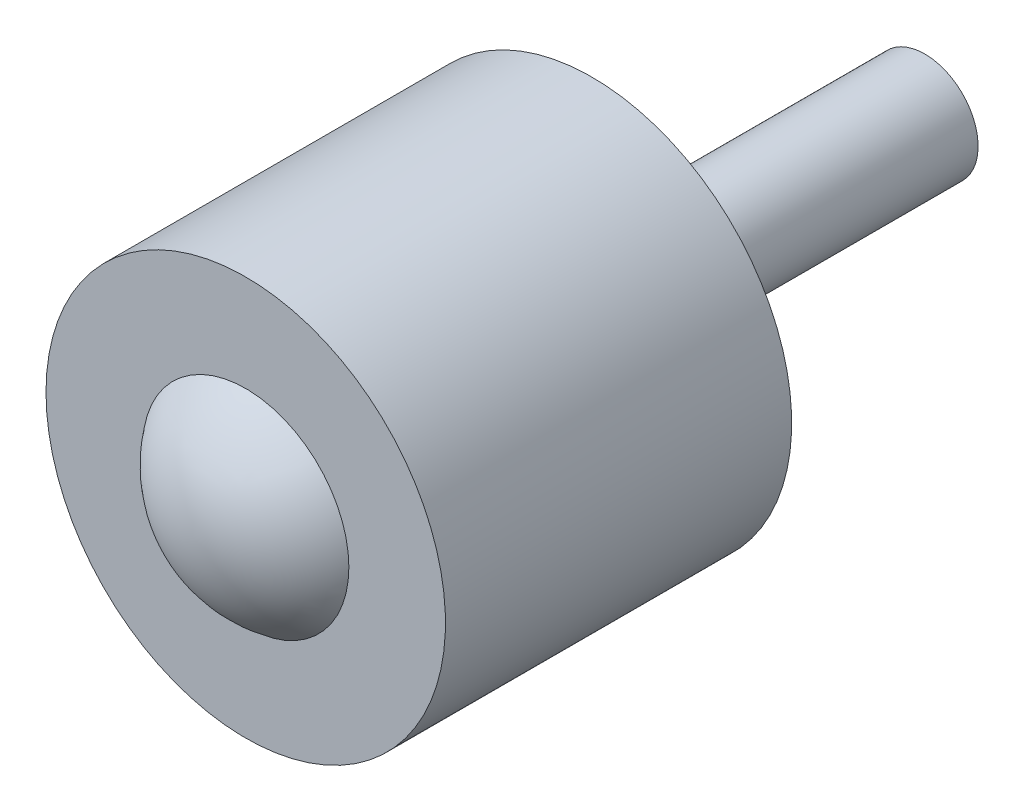
from build123d import *

# Parameters (mm, degrees)
SKETCH3_R           = 4
BOSS_EXTRUDE1_DEPTH = 25


with BuildPart() as part:
    # Sketch1 → Revolve6 (revolve)
    with BuildSketch(Plane(origin=(0, 0, 0), x_dir=(1, 0, 0), z_dir=(0, 1, 0))):
        with BuildLine():
            Line((0, 9.5), (0, -9.5))
            ThreePointArc((0, -9.5), (-9.5, 0), (0, 9.5))
        make_face()
    revolve(axis=Axis((0, 0, -9.5), (0, 0, 1)))

    # Sketch2 → Revolve7 (revolve)
    with BuildSketch(Plane(origin=(0, 0, 0), x_dir=(1, 0, 0), z_dir=(0, 1, 0)), mode=Mode.PRIVATE) as revolve7_sk:
        with BuildLine():
            ThreePointArc((-7.745966692, -5.5), (-9.050875195, -2.886461192), (-9.5, 0))
            Line((-9.5, 0), (-15, 0))
            Line((-15, 0), (-15, -5.5))
            Line((-15, -5.5), (-7.745966692, -5.5))
        make_face()
        with BuildLine():
            Line((-15, 0), (-9.5, 0))
            ThreePointArc((-9.5, 0), (-6.717514421, 6.717514421), (0, 9.5))
            Line((0, 9.5), (0, 20.5))
            Line((0, 20.5), (-15, 20.5))
            Line((-15, 20.5), (-15, 0))
        make_face()
    revolve(revolve7_sk.sketch.rotate(Axis((0, 0, -20.5), (0, 0, 1)), 180), axis=Axis((0, 0, -20.5), (0, 0, 1)))

    # Sketch3 → Boss-Extrude1 (add)
    with BuildSketch(Plane(origin=(0, 0, -20.5), x_dir=(-1, 0, 0), z_dir=(0, 0, -1))):
        Circle(SKETCH3_R)
    extrude(amount=BOSS_EXTRUDE1_DEPTH)


solid = part.part
